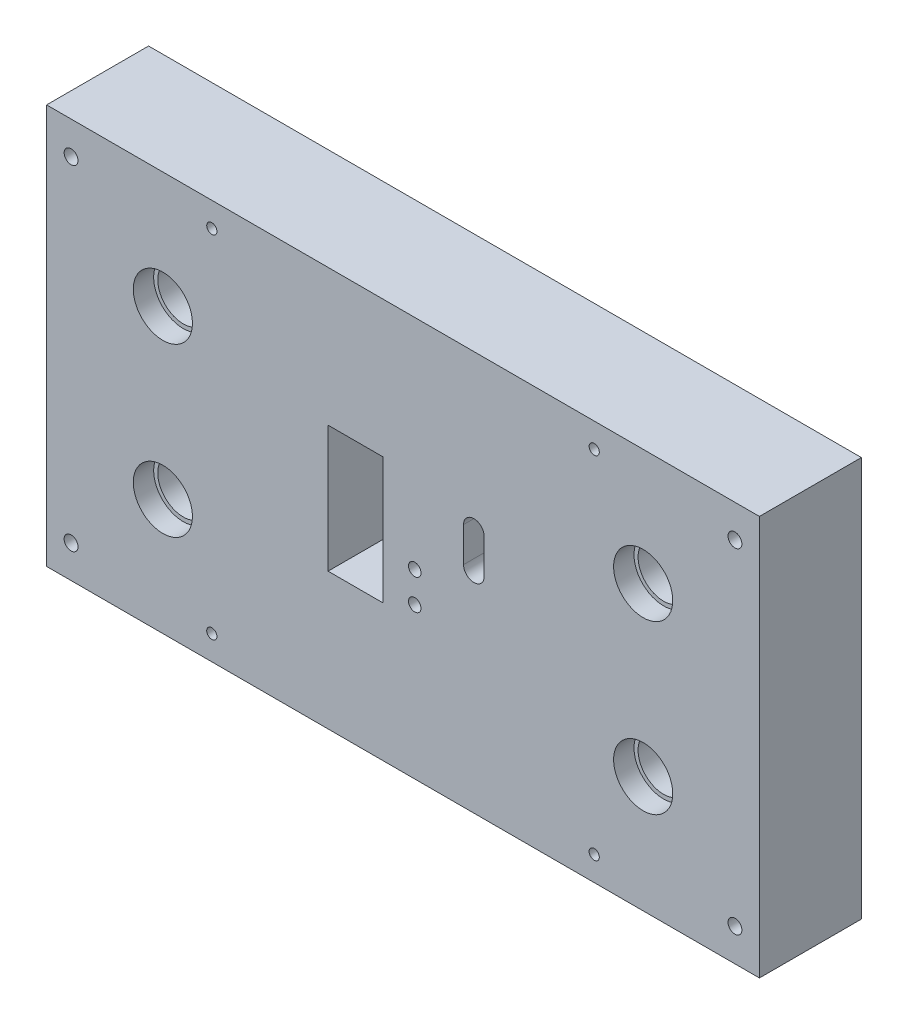
from build123d import *

# Parameters (mm, degrees)
SKETCH2_W                  = 349.5
SKETCH2_H                  = 196
SKETCH2_R                  = 3.06
SKETCH2_W_2                = 27
SKETCH2_H_2                = 62
BOSS_EXTRUDE1_DEPTH        = 50
M8X1_25_TAPPED_HOLE2_D     = 6.8
M8X1_25_TAPPED_HOLE2_DEPTH = 20
M8X1_25_TAPPED_HOLE2_TIP   = 2.042926105
M6X1_0_TAPPED_HOLE1_D      = 5
M6X1_0_TAPPED_HOLE1_DEPTH  = 20
M6X1_0_TAPPED_HOLE1_TIP    = 1.502151548
M6X1_0_TAPPED_HOLE2_D      = 5
M6X1_0_TAPPED_HOLE2_DEPTH  = 20
M6X1_0_TAPPED_HOLE2_TIP    = 1.502151548
M8X1_25_TAPPED_HOLE4_D     = 6.8
M8X1_25_TAPPED_HOLE4_DEPTH = 20
M8X1_25_TAPPED_HOLE4_TIP   = 2.042926105
M8X1_25_TAPPED_HOLE5_D     = 6.8
M8X1_25_TAPPED_HOLE5_DEPTH = 20
M8X1_25_TAPPED_HOLE5_TIP   = 2.042926105
HOLE1_D                    = 25
HOLE1_DEPTH                = 70
HOLE1_CBORE_D              = 29
HOLE1_CBORE_DEPTH          = 10


with BuildPart() as part:
    # Sketch2 → Boss-Extrude1 (new body)
    with BuildSketch(Plane.XY):
        with Locations((-34.75, 0)):
            Rectangle(SKETCH2_W, SKETCH2_H)
        with Locations((-29, -24)):
            Circle(SKETCH2_R, mode=Mode.SUBTRACT)
        with Locations((-29, -9)):
            Circle(SKETCH2_R, mode=Mode.SUBTRACT)
        with Locations((-58, 0)):
            Rectangle(SKETCH2_W_2, SKETCH2_H_2, mode=Mode.SUBTRACT)
        with BuildLine():
            Line((-5.06, 22), (-5.06, 5))
            ThreePointArc((-5.06, 5), (0, -0.06), (5.06, 5))
            Line((5.06, 5), (5.06, 22))
            ThreePointArc((5.06, 22), (0, 27.06), (-5.06, 22))
        make_face(mode=Mode.SUBTRACT)
    extrude(amount=BOSS_EXTRUDE1_DEPTH)

    # M8x1.25 Tapped Hole2
    with Locations(Plane(origin=(0, 0, 0), x_dir=(-0.9063077870366375, -0.4226182617407263, 0), z_dir=(0, 0, -1))):
        with Locations((74.606700972, 94.372083637), (120.24947324, -3.509157363), (-57.261082041, 32.881126554), (-11.618309773, -65.000114446)):
            Hole(M8X1_25_TAPPED_HOLE2_D / 2, depth=M8X1_25_TAPPED_HOLE2_DEPTH)
            with Locations((0, 0, -(M8X1_25_TAPPED_HOLE2_DEPTH + M8X1_25_TAPPED_HOLE2_TIP / 2))):  # 118° drill point
                Cone(0, M8X1_25_TAPPED_HOLE2_D / 2, M8X1_25_TAPPED_HOLE2_TIP, mode=Mode.SUBTRACT)

    # M6x1.0 Tapped Hole1
    with Locations(Plane(origin=(0, 0, 50), x_dir=(0.9063077870366375, 0.4226182617407263, 0), z_dir=(0, 0, 1))):
        with Locations((89.817329945, 53.007992242), (17.126988925, -102.876947128)):
            Hole(M6X1_0_TAPPED_HOLE1_D / 2, depth=M6X1_0_TAPPED_HOLE1_DEPTH)
            with Locations((0, 0, -(M6X1_0_TAPPED_HOLE1_DEPTH + M6X1_0_TAPPED_HOLE1_TIP / 2))):  # 118° drill point
                Cone(0, M6X1_0_TAPPED_HOLE1_D / 2, M6X1_0_TAPPED_HOLE1_TIP, mode=Mode.SUBTRACT)

    # M6x1.0 Tapped Hole2
    with Locations(Plane(origin=(0, 0, 50), x_dir=(0.9063077870366375, 0.4226182617407263, 0), z_dir=(0, 0, 1))):
        with Locations((-80.115380125, 132.248916319), (-152.805721144, -23.636023051)):
            Hole(M6X1_0_TAPPED_HOLE2_D / 2, depth=M6X1_0_TAPPED_HOLE2_DEPTH)
            with Locations((0, 0, -(M6X1_0_TAPPED_HOLE2_DEPTH + M6X1_0_TAPPED_HOLE2_TIP / 2))):  # 118° drill point
                Cone(0, M6X1_0_TAPPED_HOLE2_D / 2, M6X1_0_TAPPED_HOLE2_TIP, mode=Mode.SUBTRACT)

    # M8x1.25 Tapped Hole4
    with Locations(Plane(origin=(0, 0, 50), x_dir=(0.9063077870366375, 0.4226182617407263, 0), z_dir=(0, 0, 1))):
        with Locations((81.352699278, -128.41237604), (150.662094203, 20.222101034)):
            Hole(M8X1_25_TAPPED_HOLE4_D / 2, depth=M8X1_25_TAPPED_HOLE4_DEPTH)
            with Locations((0, 0, -(M8X1_25_TAPPED_HOLE4_DEPTH + M8X1_25_TAPPED_HOLE4_TIP / 2))):  # 118° drill point
                Cone(0, M8X1_25_TAPPED_HOLE4_D / 2, M8X1_25_TAPPED_HOLE4_TIP, mode=Mode.SUBTRACT)

    # M8x1.25 Tapped Hole5
    with Locations(Plane(origin=(0, 0, 50), x_dir=(0.9063077870366375, 0.4226182617407263, 0), z_dir=(0, 0, 1))):
        with Locations((-144.341090477, 157.784345231), (-213.650485402, 9.149868157)):
            Hole(M8X1_25_TAPPED_HOLE5_D / 2, depth=M8X1_25_TAPPED_HOLE5_DEPTH)
            with Locations((0, 0, -(M8X1_25_TAPPED_HOLE5_DEPTH + M8X1_25_TAPPED_HOLE5_TIP / 2))):  # 118° drill point
                Cone(0, M8X1_25_TAPPED_HOLE5_D / 2, M8X1_25_TAPPED_HOLE5_TIP, mode=Mode.SUBTRACT)

    # Hole1
    with Locations(Plane(origin=(83, -41, 50), x_dir=(1, 0, 0), z_dir=(0, 0, 1))):
        with Locations((0, 0), (0, 82), (-235.5, 82), (-235.5, 0)):
            CounterBoreHole(HOLE1_D / 2, HOLE1_CBORE_D / 2, HOLE1_CBORE_DEPTH, depth=HOLE1_DEPTH)


solid = part.part
